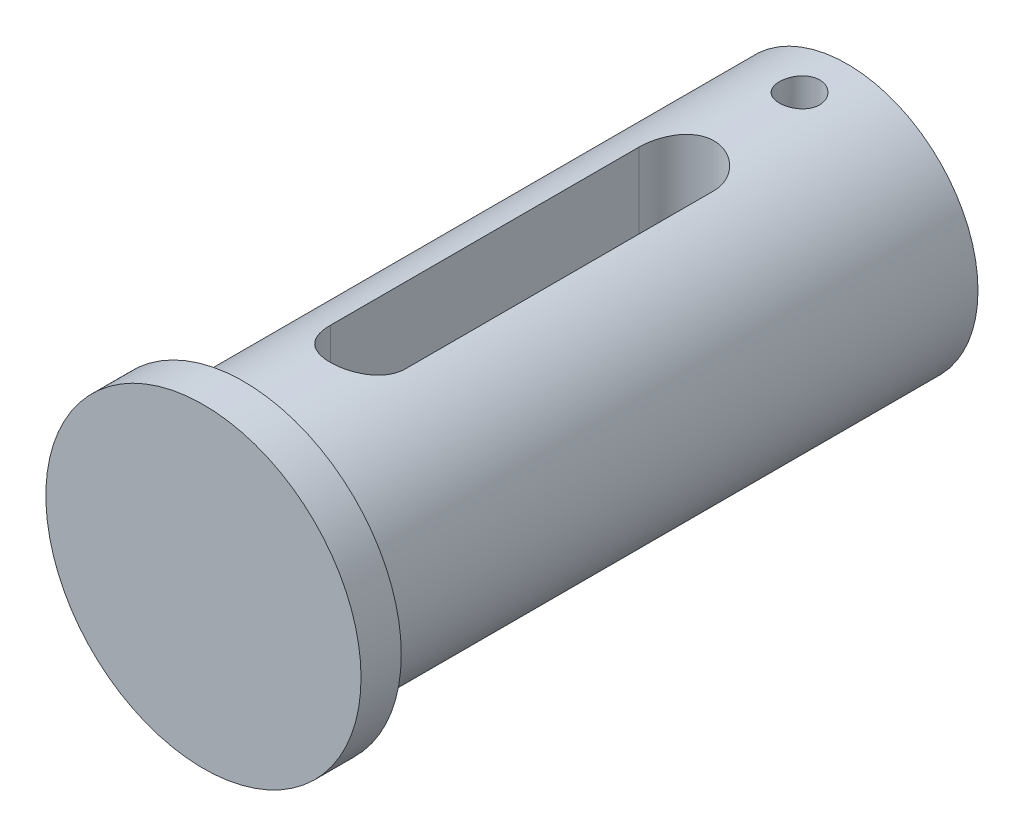
from build123d import *

# Parameters (mm, degrees)
SKETCH1_R               = 9.75
BOSS_EXTRUDE1_DEPTH     = 45
SKETCH2_R               = 11.75
BOSS_EXTRUDE2_DEPTH     = 3
CUT_EXTRUDE1_DEPTH      = 13
CUT_EXTRUDE1_DEPTH_BACK = 23
CUT_EXTRUDE2_DEPTH      = 23
CUT_EXTRUDE2_DEPTH_BACK = 23
SKETCH5_R               = 1.5


with BuildPart() as part:
    # Sketch1 → Boss-Extrude1 (new body)
    with BuildSketch(Plane.XY):
        Circle(SKETCH1_R)
    extrude(amount=BOSS_EXTRUDE1_DEPTH)

    # Sketch2 → Boss-Extrude2 (add)
    with BuildSketch(Plane.XY.offset(45)):
        Circle(SKETCH2_R)
    extrude(amount=BOSS_EXTRUDE2_DEPTH)

    # Sketch4 → Cut-Extrude1 (cut, two sides: drawn at the far end of the back side and taken through both)
    with BuildSketch(Plane(origin=(0, 0, 0), x_dir=(1, 0, 0), z_dir=(0, 1, 0)).offset(-CUT_EXTRUDE1_DEPTH_BACK)):
        with BuildLine():
            Line((2.80710702, -12.735), (2.80710702, -35.735))
            ThreePointArc((2.80710702, -35.735), (0, -38.54210702), (-2.80710702, -35.735))
            Line((-2.80710702, -35.735), (-2.80710702, -12.735))
            ThreePointArc((-2.80710702, -12.735), (0, -9.92789298), (2.80710702, -12.735))
        make_face()
    extrude(amount=CUT_EXTRUDE1_DEPTH + CUT_EXTRUDE1_DEPTH_BACK, mode=Mode.SUBTRACT)

    # Sketch5 → Cut-Extrude2 (cut, two sides: drawn at the far end of the back side and taken through both)
    with BuildSketch(Plane(origin=(0, 0, 0), x_dir=(1, 0, 0), z_dir=(0, 1, 0)).offset(-CUT_EXTRUDE2_DEPTH_BACK)):
        with Locations((0, -3.556649542)):
            Circle(SKETCH5_R)
    extrude(amount=CUT_EXTRUDE2_DEPTH + CUT_EXTRUDE2_DEPTH_BACK, mode=Mode.SUBTRACT)


solid = part.part
